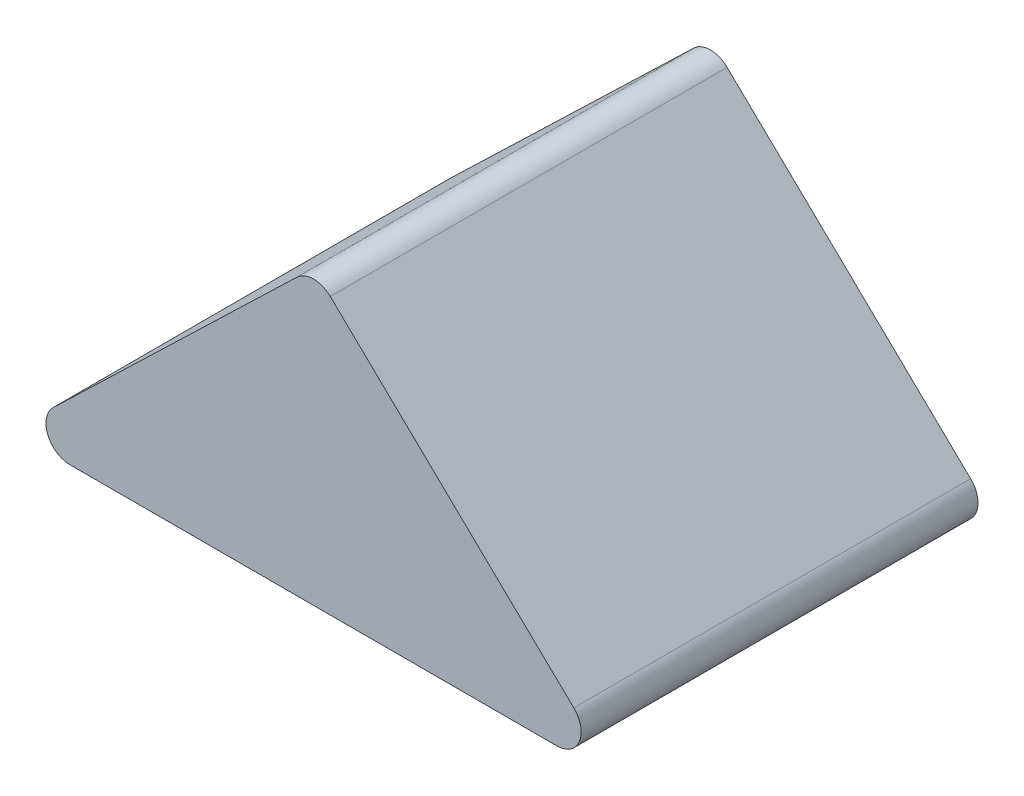
from build123d import *

# Parameters (mm, degrees)
EXTRUDE1_DEPTH = 33


with BuildPart() as part:
    # Sketch1 → Extrude1 (new body)
    with BuildSketch(Plane.XY):
        with BuildLine():
            Line((0, 0), (40.5, 0))
            ThreePointArc((40.5, 0), (42.354896339, 1.252096548), (41.887283374, 3.440640427))
            Line((41.887283374, 3.440640427), (21.637283374, 22.940640427))
            ThreePointArc((21.637283374, 22.940640427), (20.25, 23.5), (18.862716626, 22.940640427))
            Line((18.862716626, 22.940640427), (-1.387283374, 3.440640427))
            ThreePointArc((-1.387283374, 3.440640427), (-1.854896339, 1.252096548), (0, 0))
        make_face()
    extrude(amount=EXTRUDE1_DEPTH)


solid = part.part
